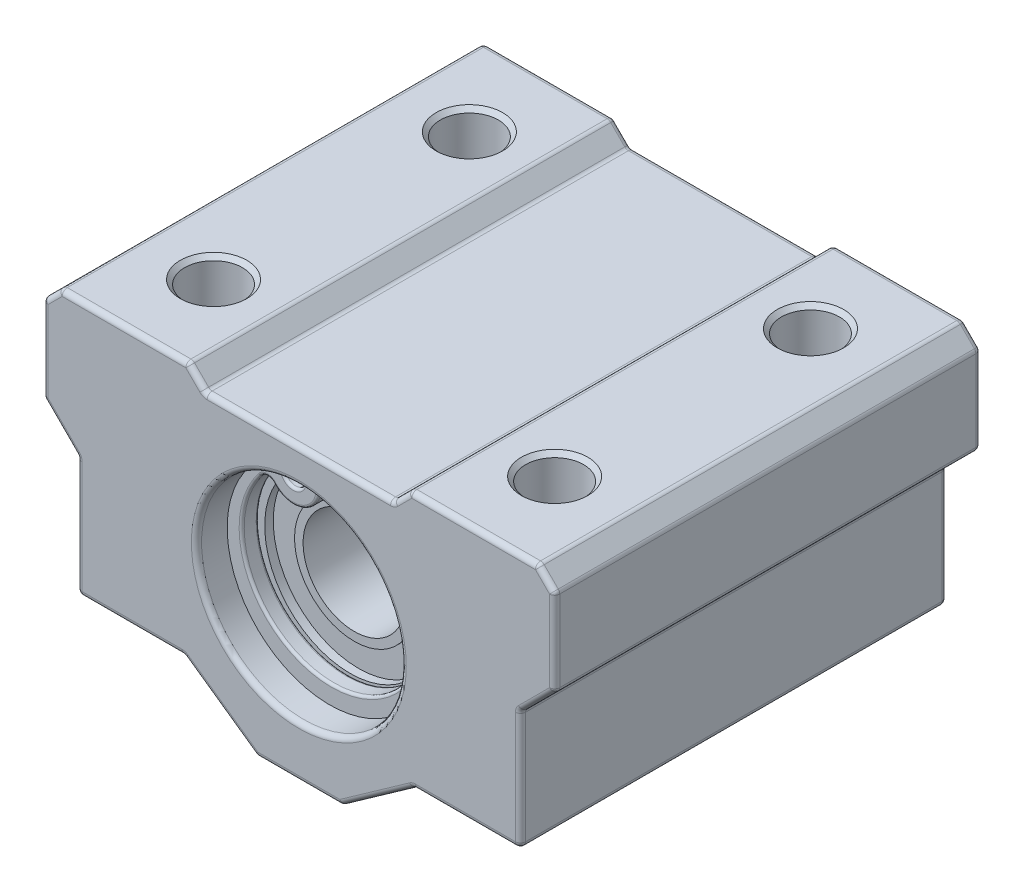
from build123d import *

# Parameters (mm, degrees)
SCHIZZO1_R                    = 6
ESTRUSIONE_ESTRUSIONE1_DEPTH  = 12.5
FORO_PER_VITE_M4_1_D          = 3.4
RIPETIZIONE_A_L1_COUNT        = 2
RIPETIZIONE_A_L1_PITCH        = 20
RIPETIZIONE_A_L1_COUNT_DIR2   = 2
RIPETIZIONE_A_L1_PITCH_DIR2   = 15
SMUSSO1_SIZE                  = 0.25
SMUSSO2_SIZE                  = 0.5
RACCORDO1_R                   = 0.3
TAGLIO_ESTRUSIONE2_DEPTH      = 22.500000058
TAGLIO_ESTRUSIONE2_DEPTH_BACK = 22.500000058
SCHIZZO8_R                    = 3
TAGLIO_ESTRUSIONE1_START      = 9.6
SCHIZZO7_R                    = 6.8
TAGLIO_ESTRUSIONE1_DEPTH      = 1.1
ESTRUSIONE_ESTRUSIONE2_START  = 9.6
SCHIZZO9_R                    = 0.6
ESTRUSIONE_ESTRUSIONE2_DEPTH  = 1
RIPETIZIONE_A_L2_COUNT        = 2
RIPETIZIONE_A_L2_PITCH        = 20.2
RACCORDO4_R                   = 0.15
RACCORDO5_R                   = 0.15


with BuildPart() as part:
    # Schizzo1 → Estrusione-Estrusione1 (new, symmetric)
    with BuildSketch(Plane.XY):
        Polygon((2.5, -9), (6.75, -6), (13, -6), (13, 1), (15, 3), (15, 8), (14, 9), (6.5, 9), (5.5, 8), (-5.5, 8), (-6.5, 9), (-14, 9), (-15, 8), (-15, 3), (-13, 1), (-13, -6), (-6.75, -6), (-2.5, -9), align=None)
        Circle(SCHIZZO1_R, mode=Mode.SUBTRACT)
    extrude(amount=ESTRUSIONE_ESTRUSIONE1_DEPTH, both=True)

    # Foro per Vite M4-1 (through all)
    with Locations(Plane(origin=(0, 9, 0), x_dir=(1, 0, 0), z_dir=(0, 1, 0))):
        with Locations((-10, 7.5)):
            foro_per_vite_m4_1 = Hole(FORO_PER_VITE_M4_1_D / 2)

    # Ripetizione a L1: Foro per Vite M4-1 2 × 2
    with Locations(*[(i * RIPETIZIONE_A_L1_PITCH, 0, j * RIPETIZIONE_A_L1_PITCH_DIR2) for i in range(RIPETIZIONE_A_L1_COUNT) for j in range(RIPETIZIONE_A_L1_COUNT_DIR2) if (i, j) != (0, 0)]):
        add(foro_per_vite_m4_1, mode=Mode.SUBTRACT)

    # Smusso1
    smusso1_edges = [part.edges().sort_by_distance(p)[0] for p in [
        (-8.3, 9, -7.5),
        (-8.3, 9, 7.5),
        (11.7, 9, -7.5),
        (11.7, 9, 7.5),
    ]]
    chamfer(smusso1_edges, length=SMUSSO1_SIZE)

    # Smusso2
    smusso2_edges = [part.edges().sort_by_distance(p)[0] for p in [
        (-8.3, -6, -7.5),
        (-8.3, -6, 7.5),
        (11.7, -6, -7.5),
        (11.7, -6, 7.5),
    ]]
    chamfer(smusso2_edges, length=SMUSSO2_SIZE)

    # Schizzo6 → Rivoluzione1 (revolve)
    with BuildSketch(Plane(origin=(0, 0, 0), x_dir=(0, 0, -1), z_dir=(1, 0, 0)), mode=Mode.PRIVATE) as rivoluzione1_sk:
        Polygon((-9.5, 5), (-9, 5), (-9, 3.5), (-9.25, 3.5), (-9.25, 0), (9.25, 0), (9.25, 3.5), (9, 3.5), (9, 5), (9.5, 5), (9.5, 6), (-9.5, 6), align=None)
    revolve(rivoluzione1_sk.sketch.rotate(Axis((0, 0, 20), (0, 0, -1)), 180), axis=Axis((0, 0, 20), (0, 0, -1)))

    # Raccordo1
    raccordo1_edges = [part.edges().sort_by_distance(p)[0] for p in [
        (9.875, -6, 12.5),
        (13, -2.5, 12.5),
        (-4.625, -7.5, -12.5),
        (14, 2, 12.5),
        (-9.875, -6, -12.5),
        (-13, -2.5, -12.5),
        (-14, 2, -12.5),
        (-15, 5.5, -12.5),
        (-14.5, 8.5, -12.5),
        (-10.25, 9, -12.5),
        (-6, 8.5, -12.5),
        (0, 8, -12.5),
        (15, 5.5, 12.5),
        (6, 8.5, -12.5),
        (10.25, 9, -12.5),
        (14.5, 8.5, -12.5),
        (15, 5.5, -12.5),
        (14, 2, -12.5),
        (13, -2.5, -12.5),
        (9.875, -6, -12.5),
        (14.5, 8.5, 12.5),
        (4.625, -7.5, -12.5),
        (0, -9, -12.5),
        (10.25, 9, 12.5),
        (6, 8.5, 12.5),
        (-2.5, -9, 0),
        (-6.75, -6, 0),
        (-13, -6, 0),
        (-13, 1, 0),
        (-15, 3, 0),
        (-15, 8, 0),
        (-14, 9, 0),
        (-6.5, 9, 0),
        (-5.5, 8, 0),
        (5.5, 8, 0),
        (6.5, 9, 0),
        (14, 9, 0),
        (15, 8, 0),
        (15, 3, 0),
        (13, 1, 0),
        (13, -6, 0),
        (6.75, -6, 0),
        (2.5, -9, 0),
        (0, 8, 12.5),
        (-6, 8.5, 12.5),
        (-10.25, 9, 12.5),
        (0, -9, 12.5),
        (-14.5, 8.5, 12.5),
        (-6, 0, -12.5),
        (-15, 5.5, 12.5),
        (-6, 0, 12.5),
        (-14, 2, 12.5),
        (-13, -2.5, 12.5),
        (-9.875, -6, 12.5),
        (-4.625, -7.5, 12.5),
        (4.625, -7.5, 12.5),
    ]]
    fillet(raccordo1_edges, radius=RACCORDO1_R)

    # Schizzo8 → Taglio-Estrusione2 (cut, two sides: drawn at the far end of the back side and taken through both)
    with BuildSketch(Plane.XY.offset(-TAGLIO_ESTRUSIONE2_DEPTH_BACK)):
        with Locations(Location((0, 0, 0), (0, 0, 90))):
            Circle(SCHIZZO8_R)
    extrude(amount=TAGLIO_ESTRUSIONE2_DEPTH + TAGLIO_ESTRUSIONE2_DEPTH_BACK, mode=Mode.SUBTRACT)

    # Schizzo7 → Taglio-Estrusione1 (cut)
    with BuildSketch(Plane.XY.offset(TAGLIO_ESTRUSIONE1_START)):
        Circle(SCHIZZO7_R)
    taglio_estrusione1 = extrude(amount=TAGLIO_ESTRUSIONE1_DEPTH, mode=Mode.SUBTRACT)

    # Specchia1: Taglio-Estrusione1 across plane
    add(taglio_estrusione1.mirror(Plane.XY), mode=Mode.SUBTRACT)


with BuildPart() as body_2:
    # Schizzo9 → Estrusione-Estrusione2 (new body)
    with BuildSketch(Plane.XY.offset(ESTRUSIONE_ESTRUSIONE2_START)):
        with BuildLine():
            ThreePointArc((-2.900285785, 5.81707335), (0, -6.5), (2.900285785, 5.81707335))
            ThreePointArc((2.900285785, 5.81707335), (0.760513792, 4.178525778), (3.367738133, 3.495998442))
            ThreePointArc((3.367738133, 3.495998442), (3.758858146, 3.669625036), (4.141039173, 3.477118617))
            ThreePointArc((4.141039173, 3.477118617), (0, -5), (-4.141039173, 3.477118617))
            ThreePointArc((-4.141039173, 3.477118617), (-3.758858146, 3.669625036), (-3.367738133, 3.495998442))
            ThreePointArc((-3.367738133, 3.495998442), (-0.760513792, 4.178525778), (-2.900285785, 5.81707335))
        make_face()
        with Locations((-2.230989066, 4.474671808)):
            Circle(SCHIZZO9_R, mode=Mode.SUBTRACT)
        with Locations((2.230989066, 4.474671808)):
            Circle(SCHIZZO9_R, mode=Mode.SUBTRACT)
    estrusione_estrusione2 = extrude(amount=ESTRUSIONE_ESTRUSIONE2_DEPTH)

    # Raccordo4
    raccordo4_edges = [body_2.edges().sort_by_distance(p)[0] for p in [
        (0, -5, 10.6),
        (-3.758858146, 3.669625036, 10.6),
        (-0.760513792, 4.178525778, 10.6),
        (-2.830989066, 4.474671808, 9.6),
        (-2.830989066, 4.474671808, 10.6),
        (0, -6.5, 10.6),
        (1.630989066, 4.474671808, 9.6),
        (1.630989066, 4.474671808, 10.6),
        (0.760513792, 4.178525778, 10.6),
        (0, -6.5, 9.6),
        (-0.760513792, 4.178525778, 9.6),
        (-3.758858146, 3.669625036, 9.6),
        (3.758858146, 3.669625036, 10.6),
        (0, -5, 9.6),
        (3.758858146, 3.669625036, 9.6),
        (0.760513792, 4.178525778, 9.6),
    ]]
    fillet(raccordo4_edges, radius=RACCORDO4_R)


with BuildPart() as ripetizione_a_l2_1:
    # Ripetizione a L2: Estrusione-Estrusione2 ×2
    with Locations(*[(0, 0, -i * RIPETIZIONE_A_L2_PITCH) for i in range(1, RIPETIZIONE_A_L2_COUNT)]):
        add(estrusione_estrusione2)

    # Raccordo5
    raccordo5_edges = [ripetizione_a_l2_1.edges().sort_by_distance(p)[0] for p in [
        (0, -5, -9.6),
        (-3.758858146, 3.669625036, -9.6),
        (-0.760513792, 4.178525778, -9.6),
        (-2.830989066, 4.474671808, -10.6),
        (-2.830989066, 4.474671808, -9.6),
        (0, -6.5, -9.6),
        (1.630989066, 4.474671808, -10.6),
        (1.630989066, 4.474671808, -9.6),
        (0.760513792, 4.178525778, -9.6),
        (0, -6.5, -10.6),
        (-0.760513792, 4.178525778, -10.6),
        (-3.758858146, 3.669625036, -10.6),
        (3.758858146, 3.669625036, -9.6),
        (0, -5, -10.6),
        (3.758858146, 3.669625036, -10.6),
        (0.760513792, 4.178525778, -10.6),
    ]]
    fillet(raccordo5_edges, radius=RACCORDO5_R)


solid = Compound([part.part, body_2.part, ripetizione_a_l2_1.part])
